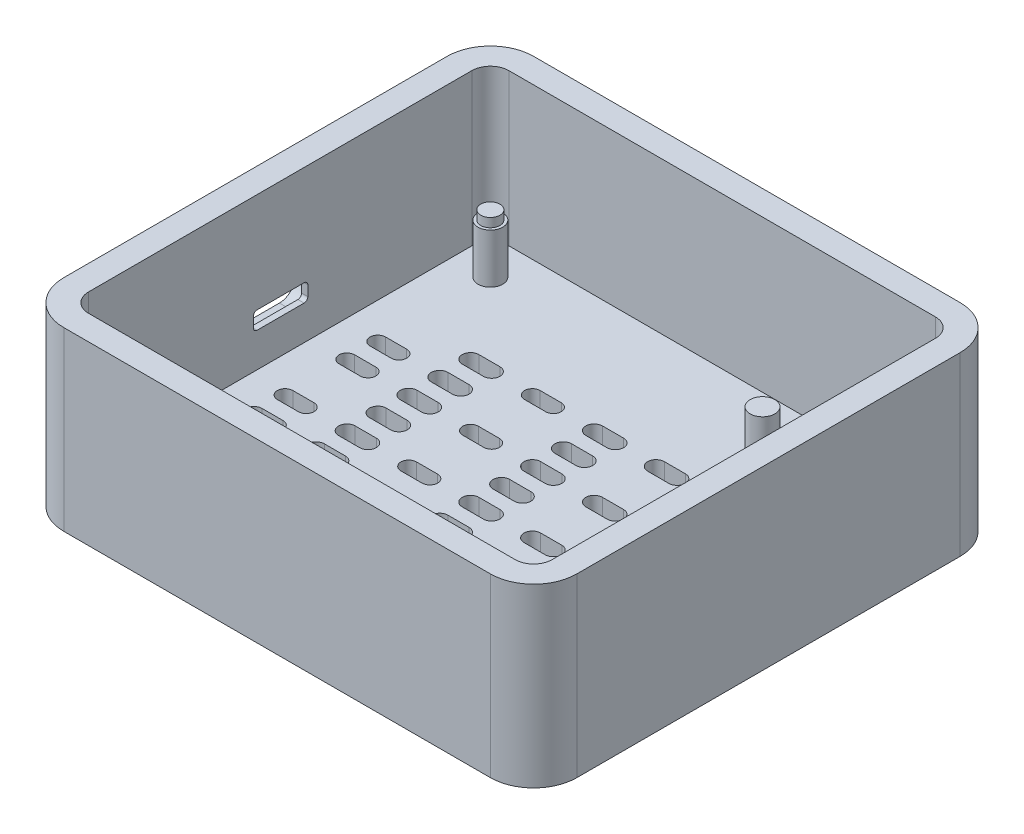
from build123d import *

# Parameters (mm, degrees)
EXTRUDE_1_DEPTH     = 4
CUT_EXTRUDE_1_DEPTH = 65
SKETCH_7_R          = 2
EXTRUDE_4_DEPTH     = 8
SKETCH_8_R          = 1.55
EXTRUDE_5_DEPTH     = 1.461836357
SKETCH_9_R          = 1.55
EXTRUDE_6_DEPTH     = 1.451210787
SKETCH_10_R         = 2
EXTRUDE_7_DEPTH     = 8
EXTRUDE_8_DEPTH     = 28.55
CUT_EXTRUDE_2_DEPTH = 9.55
CUT_EXTRUDE_3_DEPTH = 3


with BuildPart() as part:
    # 草图1 → 凸台-拉伸1 (new body)
    with BuildSketch(Plane(origin=(0, 0, 0), x_dir=(1, 0, 0), z_dir=(0, 1, 0))):
        with BuildLine():
            Line((-34.5, 34), (34.5, 34))
            ThreePointArc((34.5, 34), (36.621320344, 33.121320344), (37.5, 31))
            Line((37.5, 31), (37.5, -31))
            ThreePointArc((37.5, -31), (36.621320344, -33.121320344), (34.5, -34))
            Line((34.5, -34), (-34.5, -34))
            ThreePointArc((-34.5, -34), (-36.621320344, -33.121320344), (-37.5, -31))
            Line((-37.5, -31), (-37.5, 31))
            ThreePointArc((-37.5, 31), (-36.621320344, 33.121320344), (-34.5, 34))
        make_face()
    extrude(amount=EXTRUDE_1_DEPTH)

    # 草图2 → 切除-拉伸1 (cut)
    with BuildSketch(Plane(origin=(0, 4, 0), x_dir=(1, 0, 0), z_dir=(0, 1, 0))):
        with BuildLine():
            Line((-1.709039215, 1.342816526), (1.709039215, 1.342816526))
            ThreePointArc((1.709039215, 1.342816526), (3.051855741, 0), (1.709039215, -1.342816526))
            Line((1.709039215, -1.342816526), (-1.709039215, -1.342816526))
            ThreePointArc((-1.709039215, -1.342816526), (-3.051855741, 0), (-1.709039215, 1.342816526))
        make_face()
        with BuildLine():
            Line((18.290960785, 1.342816526), (21.709039215, 1.342816526))
            ThreePointArc((21.709039215, 1.342816526), (23.051855741, 0), (21.709039215, -1.342816526))
            Line((21.709039215, -1.342816526), (18.290960785, -1.342816526))
            ThreePointArc((18.290960785, -1.342816526), (16.948144259, 0), (18.290960785, 1.342816526))
        make_face()
        with BuildLine():
            Line((-21.709039215, 1.342816526), (-18.290960785, 1.342816526))
            ThreePointArc((-18.290960785, 1.342816526), (-16.948144259, 0), (-18.290960785, -1.342816526))
            Line((-18.290960785, -1.342816526), (-21.709039215, -1.342816526))
            ThreePointArc((-21.709039215, -1.342816526), (-23.051855741, 0), (-21.709039215, 1.342816526))
        make_face()
        with BuildLine():
            Line((-1.709039215, -3.657183474), (1.709039215, -3.657183474))
            ThreePointArc((1.709039215, -3.657183474), (3.051855741, -5), (1.709039215, -6.342816526))
            Line((1.709039215, -6.342816526), (-1.709039215, -6.342816526))
            ThreePointArc((-1.709039215, -6.342816526), (-3.051855741, -5), (-1.709039215, -3.657183474))
        make_face()
        with BuildLine():
            Line((8.290960785, -3.657183474), (11.709039215, -3.657183474))
            ThreePointArc((11.709039215, -3.657183474), (13.051855741, -5), (11.709039215, -6.342816526))
            Line((11.709039215, -6.342816526), (8.290960785, -6.342816526))
            ThreePointArc((8.290960785, -6.342816526), (6.948144259, -5), (8.290960785, -3.657183474))
        make_face()
        with BuildLine():
            Line((18.290960785, -3.657183474), (21.709039215, -3.657183474))
            ThreePointArc((21.709039215, -3.657183474), (23.051855741, -5), (21.709039215, -6.342816526))
            Line((21.709039215, -6.342816526), (18.290960785, -6.342816526))
            ThreePointArc((18.290960785, -6.342816526), (16.948144259, -5), (18.290960785, -3.657183474))
        make_face()
        with BuildLine():
            Line((28.290960785, -3.657183474), (31.709039215, -3.657183474))
            ThreePointArc((31.709039215, -3.657183474), (33.051855741, -5), (31.709039215, -6.342816526))
            Line((31.709039215, -6.342816526), (28.290960785, -6.342816526))
            ThreePointArc((28.290960785, -6.342816526), (26.948144259, -5), (28.290960785, -3.657183474))
        make_face()
        with BuildLine():
            Line((-11.709039215, -3.738566294), (-8.290960785, -3.738566294))
            ThreePointArc((-8.290960785, -3.738566294), (-7.029527078, -5), (-8.290960785, -6.261433706))
            Line((-8.290960785, -6.261433706), (-11.709039215, -6.261433706))
            ThreePointArc((-11.709039215, -6.261433706), (-12.970472922, -5), (-11.709039215, -3.738566294))
        make_face()
        with BuildLine():
            Line((-21.709039215, -3.657183474), (-18.290960785, -3.657183474))
            ThreePointArc((-18.290960785, -3.657183474), (-16.948144259, -5), (-18.290960785, -6.342816526))
            Line((-18.290960785, -6.342816526), (-21.709039215, -6.342816526))
            ThreePointArc((-21.709039215, -6.342816526), (-23.051855741, -5), (-21.709039215, -3.657183474))
        make_face()
        with BuildLine():
            Line((-31.709039215, -3.738566294), (-28.290960785, -3.738566294))
            ThreePointArc((-28.290960785, -3.738566294), (-27.029527078, -5), (-28.290960785, -6.261433706))
            Line((-28.290960785, -6.261433706), (-31.709039215, -6.261433706))
            ThreePointArc((-31.709039215, -6.261433706), (-32.970472922, -5), (-31.709039215, -3.738566294))
        make_face()
        with BuildLine():
            Line((-1.709039215, -8.657183474), (1.709039215, -8.657183474))
            ThreePointArc((1.709039215, -8.657183474), (3.051855741, -10), (1.709039215, -11.342816526))
            Line((1.709039215, -11.342816526), (-1.709039215, -11.342816526))
            ThreePointArc((-1.709039215, -11.342816526), (-3.051855741, -10), (-1.709039215, -8.657183474))
        make_face()
        with BuildLine():
            Line((18.290960785, -8.657183474), (21.709039215, -8.657183474))
            ThreePointArc((21.709039215, -8.657183474), (23.051855741, -10), (21.709039215, -11.342816526))
            Line((21.709039215, -11.342816526), (18.290960785, -11.342816526))
            ThreePointArc((18.290960785, -11.342816526), (16.948144259, -10), (18.290960785, -8.657183474))
        make_face()
        with BuildLine():
            Line((28.290960785, -8.657183474), (31.709039215, -8.657183474))
            ThreePointArc((31.709039215, -8.657183474), (33.051855741, -10), (31.709039215, -11.342816526))
            Line((31.709039215, -11.342816526), (28.290960785, -11.342816526))
            ThreePointArc((28.290960785, -11.342816526), (26.948144259, -10), (28.290960785, -8.657183474))
        make_face()
        with BuildLine():
            Line((-21.709039215, -8.657183474), (-18.290960785, -8.657183474))
            ThreePointArc((-18.290960785, -8.657183474), (-16.948144259, -10), (-18.290960785, -11.342816526))
            Line((-18.290960785, -11.342816526), (-21.709039215, -11.342816526))
            ThreePointArc((-21.709039215, -11.342816526), (-23.051855741, -10), (-21.709039215, -8.657183474))
        make_face()
        with BuildLine():
            Line((-31.709039215, -8.738566294), (-28.290960785, -8.738566294))
            ThreePointArc((-28.290960785, -8.738566294), (-27.029527078, -10), (-28.290960785, -11.261433706))
            Line((-28.290960785, -11.261433706), (-31.709039215, -11.261433706))
            ThreePointArc((-31.709039215, -11.261433706), (-32.970472922, -10), (-31.709039215, -8.738566294))
        make_face()
        with BuildLine():
            Line((-1.709039215, -13.657183474), (1.709039215, -13.657183474))
            ThreePointArc((1.709039215, -13.657183474), (3.051855741, -15), (1.709039215, -16.342816526))
            Line((1.709039215, -16.342816526), (-1.709039215, -16.342816526))
            ThreePointArc((-1.709039215, -16.342816526), (-3.051855741, -15), (-1.709039215, -13.657183474))
        make_face()
        with BuildLine():
            Line((8.290960785, -13.657183474), (11.709039215, -13.657183474))
            ThreePointArc((11.709039215, -13.657183474), (13.051855741, -15), (11.709039215, -16.342816526))
            Line((11.709039215, -16.342816526), (8.290960785, -16.342816526))
            ThreePointArc((8.290960785, -16.342816526), (6.948144259, -15), (8.290960785, -13.657183474))
        make_face()
        with BuildLine():
            Line((18.290960785, -13.657183474), (21.709039215, -13.657183474))
            ThreePointArc((21.709039215, -13.657183474), (23.051855741, -15), (21.709039215, -16.342816526))
            Line((21.709039215, -16.342816526), (18.290960785, -16.342816526))
            ThreePointArc((18.290960785, -16.342816526), (16.948144259, -15), (18.290960785, -13.657183474))
        make_face()
        with BuildLine():
            Line((-11.709039215, -13.738566294), (-8.290960785, -13.738566294))
            ThreePointArc((-8.290960785, -13.738566294), (-7.029527078, -15), (-8.290960785, -16.261433706))
            Line((-8.290960785, -16.261433706), (-11.709039215, -16.261433706))
            ThreePointArc((-11.709039215, -16.261433706), (-12.970472922, -15), (-11.709039215, -13.738566294))
        make_face()
        with BuildLine():
            Line((-21.709039215, -13.657183474), (-18.290960785, -13.657183474))
            ThreePointArc((-18.290960785, -13.657183474), (-16.948144259, -15), (-18.290960785, -16.342816526))
            Line((-18.290960785, -16.342816526), (-21.709039215, -16.342816526))
            ThreePointArc((-21.709039215, -16.342816526), (-23.051855741, -15), (-21.709039215, -13.657183474))
        make_face()
        with BuildLine():
            Line((-1.709039215, 6.342816526), (1.709039215, 6.342816526))
            ThreePointArc((1.709039215, 6.342816526), (3.051855741, 5), (1.709039215, 3.657183474))
            Line((1.709039215, 3.657183474), (-1.709039215, 3.657183474))
            ThreePointArc((-1.709039215, 3.657183474), (-3.051855741, 5), (-1.709039215, 6.342816526))
        make_face()
        with BuildLine():
            Line((8.290960785, 6.342816526), (11.709039215, 6.342816526))
            ThreePointArc((11.709039215, 6.342816526), (13.051855741, 5), (11.709039215, 3.657183474))
            Line((11.709039215, 3.657183474), (8.290960785, 3.657183474))
            ThreePointArc((8.290960785, 3.657183474), (6.948144259, 5), (8.290960785, 6.342816526))
        make_face()
        with BuildLine():
            Line((18.290960785, 6.342816526), (21.709039215, 6.342816526))
            ThreePointArc((21.709039215, 6.342816526), (23.051855741, 5), (21.709039215, 3.657183474))
            Line((21.709039215, 3.657183474), (18.290960785, 3.657183474))
            ThreePointArc((18.290960785, 3.657183474), (16.948144259, 5), (18.290960785, 6.342816526))
        make_face()
        with BuildLine():
            Line((28.290960785, 6.342816526), (31.709039215, 6.342816526))
            ThreePointArc((31.709039215, 6.342816526), (33.051855741, 5), (31.709039215, 3.657183474))
            Line((31.709039215, 3.657183474), (28.290960785, 3.657183474))
            ThreePointArc((28.290960785, 3.657183474), (26.948144259, 5), (28.290960785, 6.342816526))
        make_face()
        with BuildLine():
            Line((-11.709039215, 6.261433706), (-8.290960785, 6.261433706))
            ThreePointArc((-8.290960785, 6.261433706), (-7.029527078, 5), (-8.290960785, 3.738566294))
            Line((-8.290960785, 3.738566294), (-11.709039215, 3.738566294))
            ThreePointArc((-11.709039215, 3.738566294), (-12.970472922, 5), (-11.709039215, 6.261433706))
        make_face()
        with BuildLine():
            Line((-21.709039215, 6.342816526), (-18.290960785, 6.342816526))
            ThreePointArc((-18.290960785, 6.342816526), (-16.948144259, 5), (-18.290960785, 3.657183474))
            Line((-18.290960785, 3.657183474), (-21.709039215, 3.657183474))
            ThreePointArc((-21.709039215, 3.657183474), (-23.051855741, 5), (-21.709039215, 6.342816526))
        make_face()
        with BuildLine():
            Line((-31.709039215, 6.261433706), (-28.290960785, 6.261433706))
            ThreePointArc((-28.290960785, 6.261433706), (-27.029527078, 5), (-28.290960785, 3.738566294))
            Line((-28.290960785, 3.738566294), (-31.709039215, 3.738566294))
            ThreePointArc((-31.709039215, 3.738566294), (-32.970472922, 5), (-31.709039215, 6.261433706))
        make_face()
        with BuildLine():
            Line((-1.709039215, 11.342816526), (1.709039215, 11.342816526))
            ThreePointArc((1.709039215, 11.342816526), (3.051855741, 10), (1.709039215, 8.657183474))
            Line((1.709039215, 8.657183474), (-1.709039215, 8.657183474))
            ThreePointArc((-1.709039215, 8.657183474), (-3.051855741, 10), (-1.709039215, 11.342816526))
        make_face()
        with BuildLine():
            Line((18.290960785, 11.342816526), (21.709039215, 11.342816526))
            ThreePointArc((21.709039215, 11.342816526), (23.051855741, 10), (21.709039215, 8.657183474))
            Line((21.709039215, 8.657183474), (18.290960785, 8.657183474))
            ThreePointArc((18.290960785, 8.657183474), (16.948144259, 10), (18.290960785, 11.342816526))
        make_face()
        with BuildLine():
            Line((28.290960785, 11.342816526), (31.709039215, 11.342816526))
            ThreePointArc((31.709039215, 11.342816526), (33.051855741, 10), (31.709039215, 8.657183474))
            Line((31.709039215, 8.657183474), (28.290960785, 8.657183474))
            ThreePointArc((28.290960785, 8.657183474), (26.948144259, 10), (28.290960785, 11.342816526))
        make_face()
        with BuildLine():
            Line((-21.709039215, 11.342816526), (-18.290960785, 11.342816526))
            ThreePointArc((-18.290960785, 11.342816526), (-16.948144259, 10), (-18.290960785, 8.657183474))
            Line((-18.290960785, 8.657183474), (-21.709039215, 8.657183474))
            ThreePointArc((-21.709039215, 8.657183474), (-23.051855741, 10), (-21.709039215, 11.342816526))
        make_face()
        with BuildLine():
            Line((-31.709039215, 11.261433706), (-28.290960785, 11.261433706))
            ThreePointArc((-28.290960785, 11.261433706), (-27.029527078, 10), (-28.290960785, 8.738566294))
            Line((-28.290960785, 8.738566294), (-31.709039215, 8.738566294))
            ThreePointArc((-31.709039215, 8.738566294), (-32.970472922, 10), (-31.709039215, 11.261433706))
        make_face()
        with BuildLine():
            Line((-1.709039215, 16.342816526), (1.709039215, 16.342816526))
            ThreePointArc((1.709039215, 16.342816526), (3.051855741, 15), (1.709039215, 13.657183474))
            Line((1.709039215, 13.657183474), (-1.709039215, 13.657183474))
            ThreePointArc((-1.709039215, 13.657183474), (-3.051855741, 15), (-1.709039215, 16.342816526))
        make_face()
        with BuildLine():
            Line((8.290960785, 16.342816526), (11.709039215, 16.342816526))
            ThreePointArc((11.709039215, 16.342816526), (13.051855741, 15), (11.709039215, 13.657183474))
            Line((11.709039215, 13.657183474), (8.290960785, 13.657183474))
            ThreePointArc((8.290960785, 13.657183474), (6.948144259, 15), (8.290960785, 16.342816526))
        make_face()
        with BuildLine():
            Line((18.290960785, 16.342816526), (21.709039215, 16.342816526))
            ThreePointArc((21.709039215, 16.342816526), (23.051855741, 15), (21.709039215, 13.657183474))
            Line((21.709039215, 13.657183474), (18.290960785, 13.657183474))
            ThreePointArc((18.290960785, 13.657183474), (16.948144259, 15), (18.290960785, 16.342816526))
        make_face()
        with BuildLine():
            Line((-11.709039215, 16.261433706), (-8.290960785, 16.261433706))
            ThreePointArc((-8.290960785, 16.261433706), (-7.029527078, 15), (-8.290960785, 13.738566294))
            Line((-8.290960785, 13.738566294), (-11.709039215, 13.738566294))
            ThreePointArc((-11.709039215, 13.738566294), (-12.970472922, 15), (-11.709039215, 16.261433706))
        make_face()
        with BuildLine():
            Line((-21.709039215, 16.342816526), (-18.290960785, 16.342816526))
            ThreePointArc((-18.290960785, 16.342816526), (-16.948144259, 15), (-18.290960785, 13.657183474))
            Line((-18.290960785, 13.657183474), (-21.709039215, 13.657183474))
            ThreePointArc((-21.709039215, 13.657183474), (-23.051855741, 15), (-21.709039215, 16.342816526))
        make_face()
    extrude(amount=-CUT_EXTRUDE_1_DEPTH, mode=Mode.SUBTRACT)

    # 草图7 → 凸台-拉伸4 (add)
    with BuildSketch(Plane(origin=(0, 4, 0), x_dir=(1, 0, 0), z_dir=(0, 1, 0))):
        with Locations(Location((-31.621320344, 28.121320344, 0), (0, 0, 270))):
            Circle(SKETCH_7_R)
        with Locations(Location((-31.621320344, -28.121320344, 0), (0, 0, 270))):
            Circle(SKETCH_7_R)
    extrude(amount=EXTRUDE_4_DEPTH)

    # 草图8 → 凸台-拉伸5 (add)
    with BuildSketch(Plane(origin=(0, 12, 0), x_dir=(1, 0, 0), z_dir=(0, 1, 0))):
        with Locations(Location((-31.621320344, -28.121320344, 0), (0, 0, 270))):
            Circle(SKETCH_8_R)
    extrude(amount=EXTRUDE_5_DEPTH)

    # 草图9 → 凸台-拉伸6 (add)
    with BuildSketch(Plane(origin=(0, 12, 0), x_dir=(1, 0, 0), z_dir=(0, 1, 0))):
        with Locations(Location((-31.621320344, 28.121320344, 0), (0, 0, 270))):
            Circle(SKETCH_9_R)
    extrude(amount=EXTRUDE_6_DEPTH)

    # 草图10 → 凸台-拉伸7 (add)
    with BuildSketch(Plane(origin=(0, 4, 0), x_dir=(1, 0, 0), z_dir=(0, 1, 0))):
        with Locations(Location((16.546, -27.048136821, 0), (0, 0, 270))):
            Circle(SKETCH_10_R)
        with Locations(Location((16.546, 23.975895567, 0), (0, 0, 270))):
            Circle(SKETCH_10_R)
    extrude(amount=EXTRUDE_7_DEPTH)

    # 草图11 → 凸台-拉伸8 (add)
    with BuildSketch(Plane.XZ):
        with BuildLine():
            Line((-34.5, -38), (34.5, -38))
            ThreePointArc((34.5, -38), (39.449747468, -35.949747468), (41.5, -31))
            Line((41.5, -31), (41.5, 31))
            ThreePointArc((41.5, 31), (39.449747468, 35.949747468), (34.5, 38))
            Line((34.5, 38), (-34.5, 38))
            ThreePointArc((-34.5, 38), (-39.449747468, 35.949747468), (-41.5, 31))
            Line((-41.5, 31), (-41.5, -31))
            ThreePointArc((-41.5, -31), (-39.449747468, -35.949747468), (-34.5, -38))
        make_face()
        with BuildLine():
            Line((-34.5, -34), (34.5, -34))
            ThreePointArc((34.5, -34), (36.621320344, -33.121320344), (37.5, -31))
            Line((37.5, -31), (37.5, 31))
            ThreePointArc((37.5, 31), (36.621320344, 33.121320344), (34.5, 34))
            Line((34.5, 34), (-34.5, 34))
            ThreePointArc((-34.5, 34), (-36.621320344, 33.121320344), (-37.5, 31))
            Line((-37.5, 31), (-37.5, -31))
            ThreePointArc((-37.5, -31), (-36.621320344, -33.121320344), (-34.5, -34))
        make_face(mode=Mode.SUBTRACT)
    extrude(amount=-EXTRUDE_8_DEPTH)

    # 草图12 → 切除-拉伸2 (cut)
    with BuildSketch(Plane.ZY.offset(41.5)):
        with BuildLine():
            Line((-3.8715, 9.55), (3.7285, 9.55))
            ThreePointArc((3.7285, 9.55), (4.152764069, 9.725735931), (4.3285, 10.15))
            Line((4.3285, 10.15), (4.3285, 11.8))
            ThreePointArc((4.3285, 11.8), (4.152764069, 12.224264069), (3.7285, 12.4))
            Line((3.7285, 12.4), (-3.8715, 12.4))
            ThreePointArc((-3.8715, 12.4), (-4.295764069, 12.224264069), (-4.4715, 11.8))
            Line((-4.4715, 11.8), (-4.4715, 10.15))
            ThreePointArc((-4.4715, 10.15), (-4.295764069, 9.725735931), (-3.8715, 9.55))
        make_face()
    extrude(amount=-CUT_EXTRUDE_2_DEPTH, mode=Mode.SUBTRACT)

    # 草图13 → 切除-拉伸3 (cut)
    with BuildSketch(Plane.ZY.offset(41.5)):
        with BuildLine():
            Line((3.7285, 14.4), (-3.8715, 14.4))
            ThreePointArc((-3.8715, 14.4), (-5.709977631, 13.638477631), (-6.4715, 11.8))
            Line((-6.4715, 11.8), (-6.4715, 10.15))
            ThreePointArc((-6.4715, 10.15), (-5.709977631, 8.311522369), (-3.8715, 7.55))
            Line((-3.8715, 7.55), (3.7285, 7.55))
            ThreePointArc((3.7285, 7.55), (5.566977631, 8.311522369), (6.3285, 10.15))
            Line((6.3285, 10.15), (6.3285, 11.8))
            ThreePointArc((6.3285, 11.8), (5.566977631, 13.638477631), (3.7285, 14.4))
        make_face()
    extrude(amount=-CUT_EXTRUDE_3_DEPTH, mode=Mode.SUBTRACT)


solid = part.part
